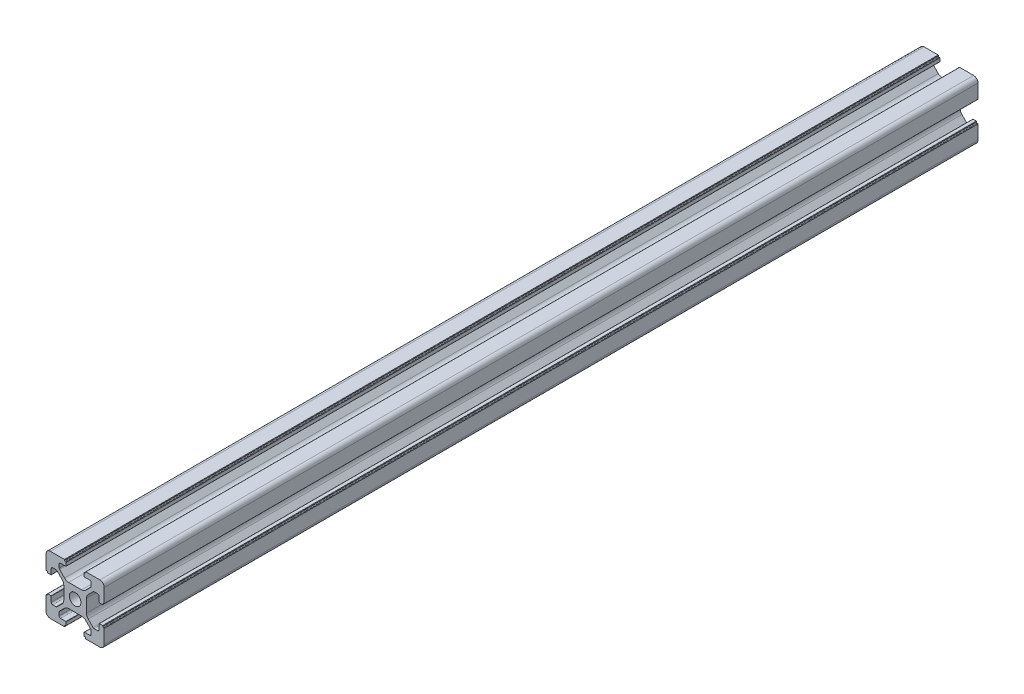
from build123d import *

# Parameters (mm, degrees)
BOSS_EXTRU_2_DEPTH      = 300
ESQUISSE3_R             = 2
ENL_V_MAT_EXTRU_1_DEPTH = 300


with BuildPart() as part:
    # Esquisse2 → Boss.-Extru.2 (new body)
    with BuildSketch(Plane.XY):
        with BuildLine():
            Line((10, -8.5), (10, -3.7))
            ThreePointArc((10, -3.7), (9.970710687, -3.629289335), (9.900000029, -3.600000004))
            Line((9.900000029, -3.600000004), (9.700000029, -3.600000004))
            ThreePointArc((9.700000029, -3.600000004), (9.558578673, -3.54142136), (9.500000029, -3.400000004))
            Line((9.500000029, -3.400000004), (9.500000029, -3.200000004))
            ThreePointArc((9.500000029, -3.200000004), (9.470710707, -3.129289326), (9.400000029, -3.100000004))
            Line((9.400000029, -3.100000004), (8.300000029, -3.100000004))
            ThreePointArc((8.300000029, -3.100000004), (8.229289342, -3.129289335), (8.200000029, -3.200000029))
            Line((8.200000029, -3.200000029), (8.200000029, -5.000000029))
            ThreePointArc((8.200000029, -5.000000029), (8.053553419, -5.353553419), (7.700000029, -5.500000029))
            Line((7.700000029, -5.500000029), (6.555634947, -5.500000029))
            ThreePointArc((6.555634947, -5.500000029), (6.364293231, -5.461939795), (6.202081557, -5.353553419))
            Line((6.202081557, -5.353553419), (4.485786438, -3.6372583))
            ThreePointArc((4.485786438, -3.6372583), (4.052240935, -2.988411603), (3.9, -2.223044738))
            Line((3.9, -2.223044738), (3.9, 2.223044738))
            ThreePointArc((3.9, 2.223044738), (4.052240935, 2.988411603), (4.485786438, 3.6372583))
            Line((4.485786438, 3.6372583), (6.202081528, 5.353553391))
            ThreePointArc((6.202081528, 5.353553391), (6.364293202, 5.461939766), (6.555634919, 5.5))
            Line((6.555634919, 5.5), (7.7, 5.5))
            ThreePointArc((7.7, 5.5), (8.053553391, 5.353553391), (8.2, 5))
            Line((8.2, 5), (8.2, 3.2))
            ThreePointArc((8.2, 3.2), (8.229289322, 3.129289322), (8.3, 3.1))
            Line((8.3, 3.1), (9.4, 3.1))
            ThreePointArc((9.4, 3.1), (9.470710678, 3.129289322), (9.5, 3.2))
            Line((9.5, 3.2), (9.5, 3.4))
            ThreePointArc((9.5, 3.4), (9.558578644, 3.541421356), (9.7, 3.6))
            Line((9.7, 3.6), (9.9, 3.6))
            ThreePointArc((9.9, 3.6), (9.970710678, 3.629289322), (10, 3.7))
            Line((10, 3.7), (10, 8.5))
            ThreePointArc((10, 8.5), (9.560660172, 9.560660172), (8.5, 10))
            Line((8.5, 10), (3.7, 10))
            ThreePointArc((3.7, 10), (3.629289335, 9.970710687), (3.600000004, 9.900000029))
            Line((3.600000004, 9.900000029), (3.600000004, 9.700000029))
            ThreePointArc((3.600000004, 9.700000029), (3.54142136, 9.558578673), (3.400000004, 9.500000029))
            Line((3.400000004, 9.500000029), (3.200000004, 9.500000029))
            ThreePointArc((3.200000004, 9.500000029), (3.129289326, 9.470710707), (3.100000004, 9.400000029))
            Line((3.100000004, 9.400000029), (3.100000004, 8.300000029))
            ThreePointArc((3.100000004, 8.300000029), (3.129289335, 8.229289342), (3.200000029, 8.200000029))
            Line((3.200000029, 8.200000029), (5.000000029, 8.200000029))
            ThreePointArc((5.000000029, 8.200000029), (5.353553419, 8.053553419), (5.500000029, 7.700000029))
            Line((5.500000029, 7.700000029), (5.500000029, 6.555634947))
            ThreePointArc((5.500000029, 6.555634947), (5.461939795, 6.364293231), (5.353553419, 6.202081557))
            Line((5.353553419, 6.202081557), (3.6372583, 4.485786438))
            ThreePointArc((3.6372583, 4.485786438), (2.988411603, 4.052240935), (2.223044738, 3.9))
            Line((2.223044738, 3.9), (-2.223044738, 3.9))
            ThreePointArc((-2.223044738, 3.9), (-2.988411603, 4.052240935), (-3.6372583, 4.485786438))
            Line((-3.6372583, 4.485786438), (-5.353553391, 6.202081528))
            ThreePointArc((-5.353553391, 6.202081528), (-5.461939766, 6.364293202), (-5.5, 6.555634919))
            Line((-5.5, 6.555634919), (-5.5, 7.7))
            ThreePointArc((-5.5, 7.7), (-5.353553391, 8.053553391), (-5, 8.2))
            Line((-5, 8.2), (-3.2, 8.2))
            ThreePointArc((-3.2, 8.2), (-3.129289322, 8.229289322), (-3.1, 8.3))
            Line((-3.1, 8.3), (-3.1, 9.4))
            ThreePointArc((-3.1, 9.4), (-3.129289322, 9.470710678), (-3.2, 9.5))
            Line((-3.2, 9.5), (-3.4, 9.5))
            ThreePointArc((-3.4, 9.5), (-3.541421356, 9.558578644), (-3.6, 9.7))
            Line((-3.6, 9.7), (-3.6, 9.9))
            ThreePointArc((-3.6, 9.9), (-3.629289322, 9.970710678), (-3.7, 10))
            Line((-3.7, 10), (-8.5, 10))
            ThreePointArc((-8.5, 10), (-9.560660172, 9.560660172), (-10, 8.5))
            Line((-10, 8.5), (-10, 3.7))
            ThreePointArc((-10, 3.7), (-9.970710687, 3.629289335), (-9.900000029, 3.600000004))
            Line((-9.900000029, 3.600000004), (-9.700000029, 3.600000004))
            ThreePointArc((-9.700000029, 3.600000004), (-9.558578673, 3.54142136), (-9.500000029, 3.400000004))
            Line((-9.500000029, 3.400000004), (-9.500000029, 3.200000004))
            ThreePointArc((-9.500000029, 3.200000004), (-9.470710707, 3.129289326), (-9.400000029, 3.100000004))
            Line((-9.400000029, 3.100000004), (-8.300000029, 3.100000004))
            ThreePointArc((-8.300000029, 3.100000004), (-8.229289342, 3.129289335), (-8.200000029, 3.200000029))
            Line((-8.200000029, 3.200000029), (-8.200000029, 5.000000029))
            ThreePointArc((-8.200000029, 5.000000029), (-8.053553419, 5.353553419), (-7.700000029, 5.500000029))
            Line((-7.700000029, 5.500000029), (-6.555634947, 5.500000029))
            ThreePointArc((-6.555634947, 5.500000029), (-6.364293231, 5.461939795), (-6.202081557, 5.353553419))
            Line((-6.202081557, 5.353553419), (-4.485786438, 3.6372583))
            ThreePointArc((-4.485786438, 3.6372583), (-4.052240935, 2.988411603), (-3.9, 2.223044738))
            Line((-3.9, 2.223044738), (-3.9, -2.223044738))
            ThreePointArc((-3.9, -2.223044738), (-4.052240935, -2.988411603), (-4.485786438, -3.6372583))
            Line((-4.485786438, -3.6372583), (-6.202081528, -5.353553391))
            ThreePointArc((-6.202081528, -5.353553391), (-6.364293202, -5.461939766), (-6.555634919, -5.5))
            Line((-6.555634919, -5.5), (-7.7, -5.5))
            ThreePointArc((-7.7, -5.5), (-8.053553391, -5.353553391), (-8.2, -5))
            Line((-8.2, -5), (-8.2, -3.2))
            ThreePointArc((-8.2, -3.2), (-8.229289322, -3.129289322), (-8.3, -3.1))
            Line((-8.3, -3.1), (-9.4, -3.1))
            ThreePointArc((-9.4, -3.1), (-9.470710678, -3.129289322), (-9.5, -3.2))
            Line((-9.5, -3.2), (-9.5, -3.4))
            ThreePointArc((-9.5, -3.4), (-9.558578644, -3.541421356), (-9.7, -3.6))
            Line((-9.7, -3.6), (-9.9, -3.6))
            ThreePointArc((-9.9, -3.6), (-9.970710678, -3.629289322), (-10, -3.7))
            Line((-10, -3.7), (-10, -8.5))
            ThreePointArc((-10, -8.5), (-9.560660172, -9.560660172), (-8.5, -10))
            Line((-8.5, -10), (-3.7, -10))
            ThreePointArc((-3.7, -10), (-3.629289335, -9.970710687), (-3.600000004, -9.900000029))
            Line((-3.600000004, -9.900000029), (-3.600000004, -9.700000029))
            ThreePointArc((-3.600000004, -9.700000029), (-3.54142136, -9.558578673), (-3.400000004, -9.500000029))
            Line((-3.400000004, -9.500000029), (-3.200000004, -9.500000029))
            ThreePointArc((-3.200000004, -9.500000029), (-3.129289326, -9.470710707), (-3.100000004, -9.400000029))
            Line((-3.100000004, -9.400000029), (-3.100000004, -8.300000029))
            ThreePointArc((-3.100000004, -8.300000029), (-3.129289335, -8.229289342), (-3.200000029, -8.200000029))
            Line((-3.200000029, -8.200000029), (-5.000000029, -8.200000029))
            ThreePointArc((-5.000000029, -8.200000029), (-5.353553419, -8.053553419), (-5.500000029, -7.700000029))
            Line((-5.500000029, -7.700000029), (-5.500000029, -6.555634947))
            ThreePointArc((-5.500000029, -6.555634947), (-5.461939795, -6.364293231), (-5.353553419, -6.202081557))
            Line((-5.353553419, -6.202081557), (-3.6372583, -4.485786438))
            ThreePointArc((-3.6372583, -4.485786438), (-2.988411603, -4.052240935), (-2.223044738, -3.9))
            Line((-2.223044738, -3.9), (2.223044738, -3.9))
            ThreePointArc((2.223044738, -3.9), (2.988411603, -4.052240935), (3.6372583, -4.485786438))
            Line((3.6372583, -4.485786438), (5.353553391, -6.202081528))
            ThreePointArc((5.353553391, -6.202081528), (5.461939766, -6.364293202), (5.5, -6.555634919))
            Line((5.5, -6.555634919), (5.5, -7.7))
            ThreePointArc((5.5, -7.7), (5.353553391, -8.053553391), (5, -8.2))
            Line((5, -8.2), (3.2, -8.2))
            ThreePointArc((3.2, -8.2), (3.129289322, -8.229289322), (3.1, -8.3))
            Line((3.1, -8.3), (3.1, -9.4))
            ThreePointArc((3.1, -9.4), (3.129289322, -9.470710678), (3.2, -9.5))
            Line((3.2, -9.5), (3.4, -9.5))
            ThreePointArc((3.4, -9.5), (3.541421356, -9.558578644), (3.6, -9.7))
            Line((3.6, -9.7), (3.6, -9.9))
            ThreePointArc((3.6, -9.9), (3.629289322, -9.970710678), (3.7, -10))
            Line((3.7, -10), (8.5, -10))
            ThreePointArc((8.5, -10), (9.560660172, -9.560660172), (10, -8.5))
        make_face()
    extrude(amount=BOSS_EXTRU_2_DEPTH)

    # Esquisse3 → Enlèv. mat.-Extru.1 (cut)
    with BuildSketch(Plane(origin=(0, 0, 0), x_dir=(-1, 0, 0), z_dir=(0, 0, -1))):
        Circle(ESQUISSE3_R)
    extrude(amount=-ENL_V_MAT_EXTRU_1_DEPTH, mode=Mode.SUBTRACT)


solid = part.part
